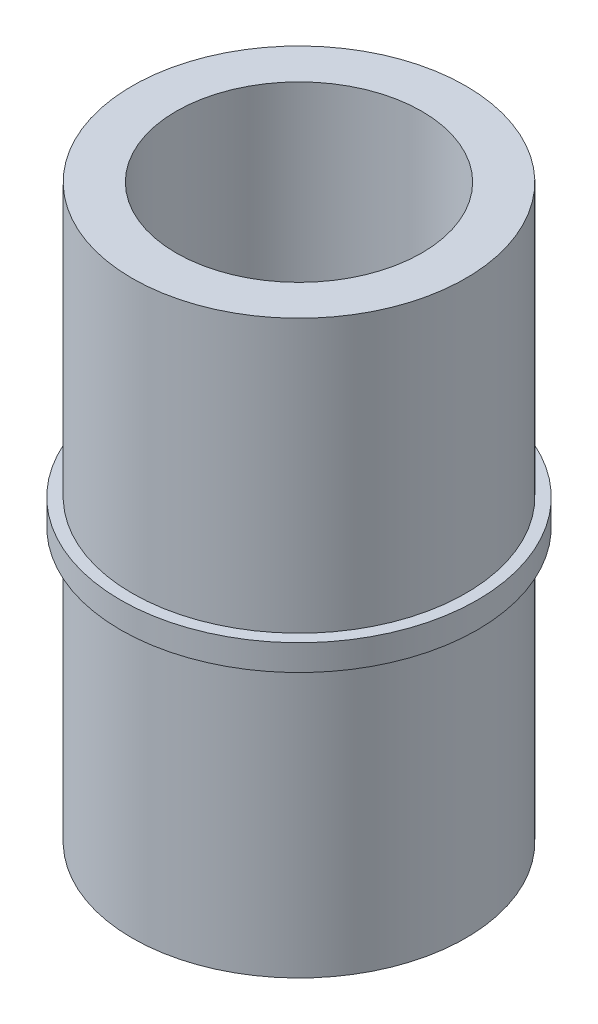
from build123d import *


with BuildPart() as part:
    # Sketch1 → Revolve1 (revolve)
    with BuildSketch(Plane.XY, mode=Mode.PRIVATE) as revolve1_sk:
        Polygon((4.75, -11.05), (4.75, 11.05), (6.45, 11.05), (6.45, 0.5), (6.9, 0.5), (6.9, -0.5), (6.45, -0.5), (6.45, -11.05), align=None)
    revolve(revolve1_sk.sketch.rotate(Axis((0, -5.670918367, 0), (0, 1, 0)), 90), axis=Axis((0, -5.670918367, 0), (0, 1, 0)))


solid = part.part
